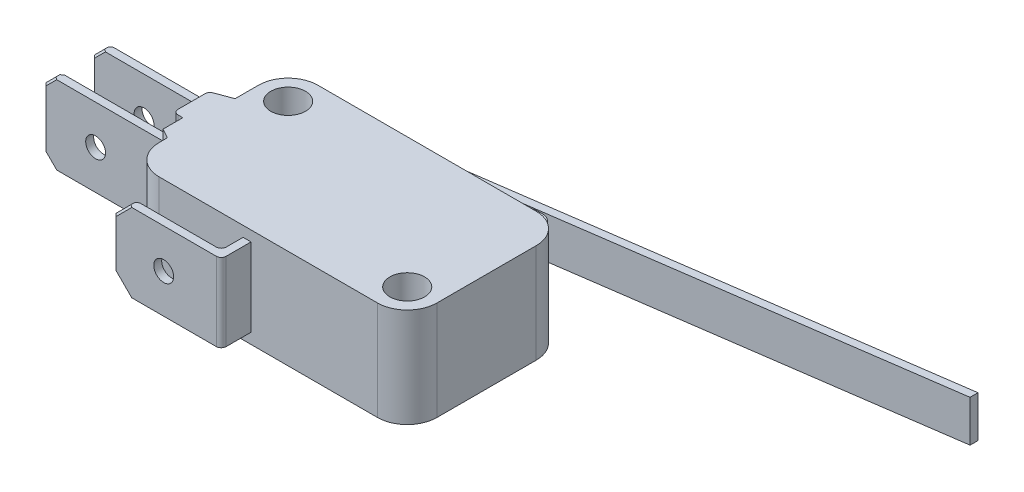
from build123d import *

# Parameters (mm, degrees)
SKETCH1_W            = 28
SKETCH1_H            = 16
BOSS_EXTRUDE1_DEPTH  = 10
SKETCH3_R            = 1.75
CUT_EXTRUDE1_DEPTH   = 10
FILLET5_R            = 3
FILLET6_R            = 3
BOSS_EXTRUDE3_DEPTH  = 10
FILLET7_R            = 0.5
FILLET8_R            = 0.5
SKETCH5_W            = 3.693864044
SKETCH5_H            = 8.2
CUT_EXTRUDE2_DEPTH   = 1
SKETCH7_W            = 0.8
SKETCH7_H            = 7.887258378
BOSS_EXTRUDE5_DEPTH  = 12
SKETCH8_W            = 0.8
SKETCH8_H            = 7.887258378
BOSS_EXTRUDE6_DEPTH  = 12
CHAMFER1_SIZE        = 1
CHAMFER3_SIZE        = 0.2
SKETCH10_R           = 1
CUT_EXTRUDE3_DEPTH   = 8
SKETCH11_W           = 0.8
SKETCH11_H           = 7.887258378
BOSS_EXTRUDE7_DEPTH  = 3
SKETCH12_W           = 0.8
SKETCH12_H           = 7.887258378
BOSS_EXTRUDE8_DEPTH  = 10
FILLET9_R            = 0.5
FILLET10_R           = 0.5
CHAMFER4_SIZE        = 1.5
CHAMFER5_SIZE        = 0.2
SKETCH13_R           = 1
CUT_EXTRUDE4_DEPTH   = 1
SKETCH14_W           = 2.614438376
SKETCH14_H           = 4.181373928
BOSS_EXTRUDE10_DEPTH = 3
FILLET12_R           = 1
SKETCH17_W           = 0.8
SKETCH17_H           = 4.181373928
BOSS_EXTRUDE11_DEPTH = 2.4
BOSS_EXTRUDE12_DEPTH = 4.18
CUT_EXTRUDE9_DEPTH   = 5
FILLET14_R           = 1


with BuildPart() as part:
    # Sketch1 → Boss-Extrude1 (new body)
    with BuildSketch(Plane(origin=(0, 0, 0), x_dir=(1, 0, 0), z_dir=(0, 1, 0))):
        with Locations((14, 8)):
            Rectangle(SKETCH1_W, SKETCH1_H)
    extrude(amount=BOSS_EXTRUDE1_DEPTH)

    # Sketch3 → Cut-Extrude1 (cut)
    with BuildSketch(Plane(origin=(0, 10, 0), x_dir=(1, 0, 0), z_dir=(0, 1, 0))):
        with Locations(Location((2.9, 13.1, 0), (0, 0, 270))):
            Circle(SKETCH3_R)
        with Locations(Location((25.1, 2.9, 0), (0, 0, 270))):
            Circle(SKETCH3_R)
    extrude(amount=-CUT_EXTRUDE1_DEPTH, mode=Mode.SUBTRACT)

    # Fillet5
    fillet5_edges = [part.edges().sort_by_distance(p)[0] for p in [
        (0, 5, -16),
        (28, 5, 0),
    ]]
    fillet(fillet5_edges, radius=FILLET5_R)

    # Fillet6
    fillet6_edges = [part.edges().sort_by_distance(p)[0] for p in [
        (28, 5, -16),
        (0, 5, 0),
    ]]
    fillet(fillet6_edges, radius=FILLET6_R)

    # Sketch4 → Boss-Extrude3 (add)
    with BuildSketch(Plane(origin=(0, 10, 0), x_dir=(1, 0, 0), z_dir=(0, 1, 0))):
        Polygon((0, 10.651040916), (-1.949468991, 9.930649363), (-1.949468991, 6.357507258), (-0.974734495, 6.357507258), (-0.974734495, 4.369226571), (0.098482911, 3.762363811), align=None)
    extrude(amount=-BOSS_EXTRUDE3_DEPTH)

    # Fillet7
    fillet7_edges = [part.edges().sort_by_distance(p)[0] for p in [
        (-1.949468991, 5, -9.930649363),
    ]]
    fillet(fillet7_edges, radius=FILLET7_R)

    # Fillet8
    fillet8_edges = [part.edges().sort_by_distance(p)[0] for p in [
        (-1.949468991, 5, -6.357507258),
    ]]
    fillet(fillet8_edges, radius=FILLET8_R)

    # Sketch5 → Cut-Extrude2 (cut)
    with BuildSketch(Plane.ZY.offset(1.949468991)):
        with Locations((-8.20443928, 5)):
            Rectangle(SKETCH5_W, SKETCH5_H)
    extrude(amount=-CUT_EXTRUDE2_DEPTH, mode=Mode.SUBTRACT)

    # Sketch7 → Boss-Extrude5 (add)
    with BuildSketch(Plane.ZY.offset(0.949468991)):
        with Locations((-9.651371302, 5.008233046)):
            Rectangle(SKETCH7_W, SKETCH7_H)
    extrude(amount=BOSS_EXTRUDE5_DEPTH)

    # Sketch8 → Boss-Extrude6 (add)
    with BuildSketch(Plane.ZY.offset(0.974734495)):
        with Locations((-4.769226571, 5.008233046)):
            Rectangle(SKETCH8_W, SKETCH8_H)
    extrude(amount=BOSS_EXTRUDE6_DEPTH)

    # Chamfer1
    chamfer1_edges = [part.edges().sort_by_distance(p)[0] for p in [
        (-12.949468991, 1.064603857, -9.651371302),
        (-12.949468991, 8.951862235, -9.651371302),
        (-12.974734495, 8.951862235, -4.769226571),
        (-12.974734495, 1.064603857, -4.769226571),
    ]]
    chamfer(chamfer1_edges, length=CHAMFER1_SIZE)

    # Chamfer3
    chamfer3_edges = [part.edges().sort_by_distance(p)[0] for p in [
        (-12.949468991, 5.008233046, -10.051371302),
        (-12.949468991, 5.008233046, -9.251371302),
        (-12.449468991, 8.451862235, -9.251371302),
        (-12.449468991, 1.564603857, -9.251371302),
        (-12.449468991, 8.451862235, -10.051371302),
        (-12.449468991, 1.564603857, -10.051371302),
        (-12.974734495, 5.008233046, -4.369226571),
        (-12.974734495, 5.008233046, -5.169226571),
        (-12.474734495, 8.451862235, -4.369226571),
        (-12.474734495, 1.564603857, -4.369226571),
        (-12.474734495, 8.451862235, -5.169226571),
        (-12.474734495, 1.564603857, -5.169226571),
    ]]
    chamfer(chamfer3_edges, length=CHAMFER3_SIZE)

    # Sketch10 → Cut-Extrude3 (cut)
    with BuildSketch(Plane.XY.offset(-4.369226571)):
        with Locations((-7.774734495, 5.008233046)):
            Circle(SKETCH10_R)
    extrude(amount=-CUT_EXTRUDE3_DEPTH, mode=Mode.SUBTRACT)

    # Sketch11 → Boss-Extrude7 (add)
    with BuildSketch(Plane.XY):
        with Locations((11.855374497, 5.008233046)):
            Rectangle(SKETCH11_W, SKETCH11_H)
    extrude(amount=BOSS_EXTRUDE7_DEPTH)

    # Sketch12 → Boss-Extrude8 (add)
    with BuildSketch(Plane.ZY.offset(-11.455374497)):
        with Locations((2.6, 5.008233046)):
            Rectangle(SKETCH12_W, SKETCH12_H)
    extrude(amount=BOSS_EXTRUDE8_DEPTH)

    # Fillet9
    fillet9_edges = [part.edges().sort_by_distance(p)[0] for p in [
        (11.455374497, 5.008233046, 2.2),
    ]]
    fillet(fillet9_edges, radius=FILLET9_R)

    # Fillet10
    fillet10_edges = [part.edges().sort_by_distance(p)[0] for p in [
        (12.255374497, 5.008233046, 3),
    ]]
    fillet(fillet10_edges, radius=FILLET10_R)

    # Chamfer4
    chamfer4_edges = [part.edges().sort_by_distance(p)[0] for p in [
        (1.455374497, 8.951862235, 2.6),
        (1.455374497, 1.064603857, 2.6),
    ]]
    chamfer(chamfer4_edges, length=CHAMFER4_SIZE)

    # Chamfer5
    chamfer5_edges = [part.edges().sort_by_distance(p)[0] for p in [
        (1.455374497, 5.008233046, 3),
        (1.455374497, 5.008233046, 2.2),
        (2.205374497, 8.201862235, 3),
        (2.205374497, 1.814603857, 3),
        (2.205374497, 8.201862235, 2.2),
        (2.205374497, 1.814603857, 2.2),
    ]]
    chamfer(chamfer5_edges, length=CHAMFER5_SIZE)

    # Sketch13 → Cut-Extrude4 (cut)
    with BuildSketch(Plane.XY.offset(3)):
        with Locations((6.455374497, 5.008233046)):
            Circle(SKETCH13_R)
    extrude(amount=-CUT_EXTRUDE4_DEPTH, mode=Mode.SUBTRACT)

    # Sketch14 → Boss-Extrude10 (add)
    with BuildSketch(Plane(origin=(0, 0, -16), x_dir=(-1, 0, 0), z_dir=(0, 0, -1))):
        with Locations((-22.392780812, 5)):
            Rectangle(SKETCH14_W, SKETCH14_H)
    extrude(amount=BOSS_EXTRUDE10_DEPTH)

    # Fillet12
    fillet12_edges = [part.edges().sort_by_distance(p)[0] for p in [
        (23.7, 5, -19),
        (21.085561624, 5, -19),
    ]]
    fillet(fillet12_edges, radius=FILLET12_R)

    # Sketch17 → Boss-Extrude11 (add)
    with BuildSketch(Plane(origin=(0, 0, -16), x_dir=(-1, 0, 0), z_dir=(0, 0, -1))):
        with Locations((-11.087924536, 5)):
            Rectangle(SKETCH17_W, SKETCH17_H)
    extrude(amount=BOSS_EXTRUDE11_DEPTH)

    # Sketch18 → Boss-Extrude12 (add)
    with BuildSketch(Plane(origin=(0, 7.090686964, 0), x_dir=(1, 0, 0), z_dir=(0, 1, 0))):
        Polygon((60.18861552, 25.33460318), (11.487924536, 18.4), (11.487924536, 17.599656508), (60.18861552, 24.534259688), align=None)
    extrude(amount=-BOSS_EXTRUDE12_DEPTH)

    # Sketch20 → Cut-Extrude9 (cut)
    with BuildSketch(Plane(origin=(0, 7.090686964, 0), x_dir=(1, 0, 0), z_dir=(0, 1, 0))):
        Polygon((11.956915688, 18.464207931), (10.687924536, 18.283513368), (10.687924536, 18.4), align=None)
    extrude(amount=-CUT_EXTRUDE9_DEPTH, mode=Mode.SUBTRACT)

    # Fillet14
    fillet14_edges = [part.edges().sort_by_distance(p)[0] for p in [
        (11.487924536, 5.000686964, -17.599656508),
    ]]
    fillet(fillet14_edges, radius=FILLET14_R)


solid = part.part
